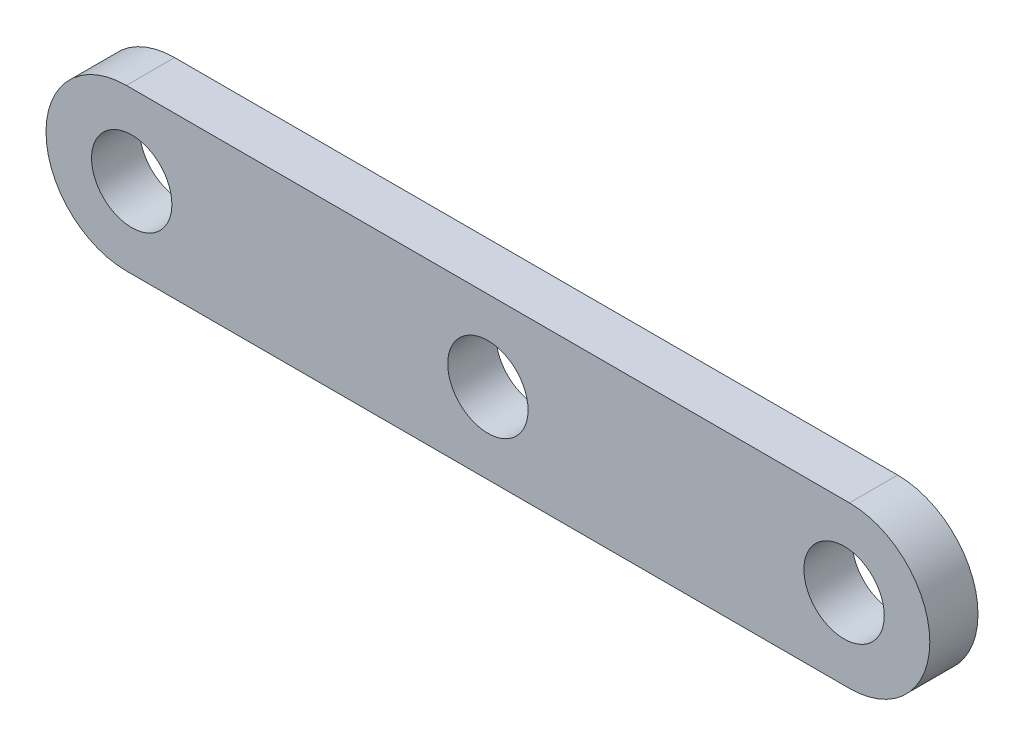
from build123d import *

# Parameters (mm, degrees)
ESBO_O1_R                = 2.5
RESSALTO_EXTRUS_O1_DEPTH = 3


with BuildPart() as part:
    # Esboço1 → Ressalto-extrusão1 (new body)
    with BuildSketch(Plane.XY):
        with BuildLine():
            Line((-65.218297244, 5), (-20.218297244, 5))
            ThreePointArc((-20.218297244, 5), (-15.218297244, 0), (-20.218297244, -5))
            Line((-20.218297244, -5), (-65.218297244, -5))
            ThreePointArc((-65.218297244, -5), (-70.218297244, 0), (-65.218297244, 5))
        make_face()
        with Locations((-64.884380005, 0)):
            Circle(ESBO_O1_R, mode=Mode.SUBTRACT)
        with Locations((-42.718297244, 0)):
            Circle(ESBO_O1_R, mode=Mode.SUBTRACT)
        with Locations((-20.552214482, 0)):
            Circle(ESBO_O1_R, mode=Mode.SUBTRACT)
    extrude(amount=RESSALTO_EXTRUS_O1_DEPTH)


solid = part.part
